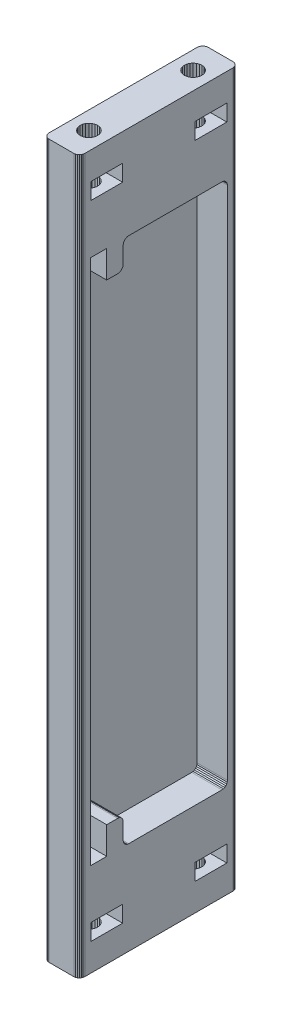
from build123d import *

# Parameters (mm, degrees)
BOSS_EXTRUDE1_DEPTH = 129.999995232
SKETCH2_W           = 5.800001324
SKETCH2_H           = 3.000000492
CUT_EXTRUDE1_DEPTH  = 146.045679533
CUT_EXTRUDE2_REACH  = 146.936
SKETCH4_W           = 5.800001324
SKETCH4_H           = 2.999998629
CUT_EXTRUDE3_DEPTH  = 146.045679533
SKETCH5_W           = 5.800001323
SKETCH5_H           = 2.999998629
CUT_EXTRUDE4_DEPTH  = 146.045679533
CUT_EXTRUDE5_REACH  = 146.936
CUT_EXTRUDE6_REACH  = 146.936
SKETCH8_W           = 5.800001323
SKETCH8_H           = 3.000000492
CUT_EXTRUDE7_DEPTH  = 146.045679533
CUT_EXTRUDE8_REACH  = 146.936
CUT_EXTRUDE9_DEPTH  = 5.49999997
CUT_EXTRUDE10_DEPTH = 6.999999285
CUT_EXTRUDE11_DEPTH = 6.999999285
CUT_EXTRUDE12_DEPTH = 6.999999285
CUT_EXTRUDE13_DEPTH = 6.999999285


with BuildPart() as part:
    # Sketch1 → Boss-Extrude1 (new body)
    with BuildSketch(Plane(origin=(0, 129.999995232, 0), x_dir=(1, 0, 0), z_dir=(0, 1, 0))):
        Polygon((-2.749999985, 35.133976489), (-2.508819103, 35.034071654), (-2.249999903, 35.000000149), (2.249999903, 35.000000149), (2.508819103, 35.034071654), (2.749999985, 35.133976489), (2.957106801, 35.292893648), (3.116025357, 35.500001162), (3.215926001, 35.741180182), (3.250000067, 35.99999845), (3.250000067, 63.000001013), (3.215926001, 63.258819282), (3.116025357, 63.500002027), (2.957106801, 63.707105815), (2.749999985, 63.8660267), (2.508819103, 63.965924084), (2.249999903, 64.00000304), (-2.249999903, 64.00000304), (-2.508819103, 63.965924084), (-2.749999985, 63.8660267), (-2.957106801, 63.707105815), (-3.116025357, 63.500002027), (-3.215926001, 63.258819282), (-3.250000067, 63.000001013), (-3.250000067, 35.99999845), (-3.215926001, 35.741180182), (-3.116025357, 35.500001162), (-2.957106801, 35.292893648), align=None)
    extrude(amount=-BOSS_EXTRUDE1_DEPTH)

    # Sketch2 → Cut-Extrude1 (cut, through all)
    with BuildSketch(Plane(origin=(3.250000067, 0, 0), x_dir=(0, 0, -1), z_dir=(1, 0, 0))):
        with Locations((39.999999106, 6.500000134)):
            Rectangle(SKETCH2_W, SKETCH2_H)
    extrude(amount=-CUT_EXTRUDE1_DEPTH, mode=Mode.SUBTRACT)

    # Sketch3 → Cut-Extrude2 (cut, up to next)
    with BuildSketch(Plane.XZ, mode=Mode.PRIVATE) as cut_extrude2_sk1:
        Polygon((-1.545481267, -40.414113551), (-1.385640586, -40.799997747), (-1.131370896, -41.13136977), (-0.800000038, -41.385639459), (-0.414110487, -41.545484215), (0, -41.600000113), (0.414110487, -41.545484215), (0.800000038, -41.385639459), (1.131370896, -41.13136977), (1.385640586, -40.799997747), (1.545481267, -40.414113551), (1.600000076, -39.999999106), (1.545481267, -39.585888386), (1.385640586, -39.200000465), (1.131370896, -38.868628442), (0.800000038, -38.614362478), (0.414110487, -38.454517722), (0, -38.400001824), (-0.414110487, -38.454517722), (-0.800000038, -38.614362478), (-1.131370896, -38.868628442), (-1.385640586, -39.200000465), (-1.545481267, -39.585888386), (-1.600000076, -39.999999106), align=None)
    cut_extrude2_tool1 = extrude(cut_extrude2_sk1.sketch, amount=-CUT_EXTRUDE2_REACH, mode=Mode.PRIVATE) & part.part
    add(cut_extrude2_tool1.solids().sort_by_distance((0, 0, -40))[0], mode=Mode.SUBTRACT)

    # Sketch4 → Cut-Extrude3 (cut, through all)
    with BuildSketch(Plane(origin=(3.250000067, 0, 0), x_dir=(0, 0, -1), z_dir=(1, 0, 0))):
        with Locations((39.999999106, 123.500000686)):
            Rectangle(SKETCH4_W, SKETCH4_H)
    extrude(amount=-CUT_EXTRUDE3_DEPTH, mode=Mode.SUBTRACT)

    # Sketch5 → Cut-Extrude4 (cut, through all)
    with BuildSketch(Plane(origin=(3.250000067, 0, 0), x_dir=(0, 0, -1), z_dir=(1, 0, 0))):
        with Locations((59.000000357, 123.500000686)):
            Rectangle(SKETCH5_W, SKETCH5_H)
    extrude(amount=-CUT_EXTRUDE4_DEPTH, mode=Mode.SUBTRACT)

    # Sketch6 → Cut-Extrude5 (cut, up to next)
    with BuildSketch(Plane(origin=(0, 129.999995232, 0), x_dir=(-1, 0, 0), z_dir=(0, 1, 0)), mode=Mode.PRIVATE) as cut_extrude5_sk1:
        Polygon((1.545481267, -39.585888386), (1.385640586, -39.200000465), (1.131370896, -38.868628442), (0.800000038, -38.614362478), (0.414110487, -38.454517722), (0, -38.400001824), (-0.414110487, -38.454517722), (-0.800000038, -38.614362478), (-1.131370896, -38.868628442), (-1.385640586, -39.200000465), (-1.545481267, -39.585888386), (-1.600000076, -39.999999106), (-1.545481267, -40.414113551), (-1.385640586, -40.799997747), (-1.131370896, -41.13136977), (-0.800000038, -41.385639459), (-0.414110487, -41.545484215), (0, -41.600000113), (0.414110487, -41.545484215), (0.800000038, -41.385639459), (1.131370896, -41.13136977), (1.385640586, -40.799997747), (1.545481267, -40.414113551), (1.600000076, -39.999999106), align=None)
    cut_extrude5_tool1 = extrude(cut_extrude5_sk1.sketch, amount=-CUT_EXTRUDE5_REACH, mode=Mode.PRIVATE) & part.part
    add(cut_extrude5_tool1.solids().sort_by_distance((0, 129.999995, -40))[0], mode=Mode.SUBTRACT)

    # Sketch7 → Cut-Extrude6 (cut, up to next)
    with BuildSketch(Plane(origin=(0, 129.999995232, 0), x_dir=(-1, 0, 0), z_dir=(0, 1, 0)), mode=Mode.PRIVATE) as cut_extrude6_sk1:
        Polygon((-1.600000076, -59.000000358), (-1.545481267, -59.414111078), (-1.385640586, -59.799998999), (-1.131370896, -60.131371021), (-0.800000038, -60.385640711), (-0.414110487, -60.545481741), (0, -60.59999764), (0.414110487, -60.545481741), (0.800000038, -60.385640711), (1.131370896, -60.131371021), (1.385640586, -59.799998999), (1.545481267, -59.414111078), (1.600000076, -59.000000358), (1.545481267, -58.585889637), (1.385640586, -58.200001717), (1.131370896, -57.868629694), (0.800000038, -57.614360005), (0.414110487, -57.454518974), (0, -57.400003076), (-0.414110487, -57.454518974), (-0.800000038, -57.614360005), (-1.131370896, -57.868629694), (-1.385640586, -58.200001717), (-1.545481267, -58.585889637), align=None)
    cut_extrude6_tool1 = extrude(cut_extrude6_sk1.sketch, amount=-CUT_EXTRUDE6_REACH, mode=Mode.PRIVATE) & part.part
    add(cut_extrude6_tool1.solids().sort_by_distance((0, 129.999995, -59))[0], mode=Mode.SUBTRACT)

    # Sketch8 → Cut-Extrude7 (cut, through all)
    with BuildSketch(Plane(origin=(3.250000067, 0, 0), x_dir=(0, 0, -1), z_dir=(1, 0, 0))):
        with Locations((59.000000357, 6.500000134)):
            Rectangle(SKETCH8_W, SKETCH8_H)
    extrude(amount=-CUT_EXTRUDE7_DEPTH, mode=Mode.SUBTRACT)

    # Sketch9 → Cut-Extrude8 (cut, up to next)
    with BuildSketch(Plane.XZ, mode=Mode.PRIVATE) as cut_extrude8_sk1:
        Polygon((-0.800000038, -57.614360005), (-1.131370896, -57.868629694), (-1.385640586, -58.200001717), (-1.545481267, -58.585889637), (-1.600000076, -59.000000358), (-1.545481267, -59.414111078), (-1.385640586, -59.799998999), (-1.131370896, -60.131371021), (-0.800000038, -60.385640711), (-0.414110487, -60.545481741), (0, -60.59999764), (0.414110487, -60.545481741), (0.800000038, -60.385640711), (1.131370896, -60.131371021), (1.385640586, -59.799998999), (1.545481267, -59.414111078), (1.600000076, -59.000000358), (1.545481267, -58.585889637), (1.385640586, -58.200001717), (1.131370896, -57.868629694), (0.800000038, -57.614360005), (0.414110487, -57.454518974), (0, -57.400003076), (-0.414110487, -57.454518974), align=None)
    cut_extrude8_tool1 = extrude(cut_extrude8_sk1.sketch, amount=-CUT_EXTRUDE8_REACH, mode=Mode.PRIVATE) & part.part
    add(cut_extrude8_tool1.solids().sort_by_distance((0, 0, -59))[0], mode=Mode.SUBTRACT)

    # Sketch10 → Cut-Extrude9 (cut)
    with BuildSketch(Plane(origin=(3.250000067, 0, 0), x_dir=(0, 0, -1), z_dir=(1, 0, 0))):
        Polygon((61.999998987, 17.999999225), (61.999998987, 112.000003457), (61.965927482, 112.258821726), (61.866022646, 112.49999702), (61.707109213, 112.707108259), (61.500001699, 112.866029143), (61.258818954, 112.965926528), (61.000000685, 112.999998033), (43.999999762, 112.999998033), (43.741181493, 112.965926528), (43.499998748, 112.866029143), (43.292891234, 112.707108259), (43.133977801, 112.49999702), (43.034072965, 112.258821726), (43.00000146, 112.000003457), (43.00000146, 108.999997377), (42.96592623, 108.741179109), (42.86602512, 108.499996364), (42.707107961, 108.292892575), (42.500000447, 108.133971691), (42.258821428, 108.034074306), (41.999999434, 108.000002801), (39.999999106, 108.000002801), (39.999999106, 112.999998033), (37.000000477, 112.999998033), (37.000000477, 17.000000924), (39.999999106, 17.000000924), (39.999999106, 21.999999881), (41.999999434, 21.999999881), (42.258821428, 21.96592465), (42.500000447, 21.866025403), (42.707107961, 21.707108244), (42.86602512, 21.50000073), (42.96592623, 21.258819848), (43.00000146, 20.999999717), (43.00000146, 17.999999225), (43.034072965, 17.741180956), (43.133977801, 17.500000075), (43.292891234, 17.29289256), (43.499998748, 17.133973539), (43.741181493, 17.034074292), (43.999999762, 17.000000924), (61.000000685, 17.000000924), (61.258818954, 17.034074292), (61.500001699, 17.133973539), (61.707109213, 17.29289256), (61.866022646, 17.500000075), (61.965927482, 17.741180956), align=None)
    extrude(amount=-CUT_EXTRUDE9_DEPTH, mode=Mode.SUBTRACT)

    # Sketch11 → Cut-Extrude10 (cut)
    with BuildSketch(Plane(origin=(0, 122.000001371, 0), x_dir=(-1, 0, 0), z_dir=(0, 1, 0))):
        Polygon((1.545481267, -40.414113551), (1.600000076, -39.999999106), (1.545481267, -39.585888386), (1.385640586, -39.200000465), (1.131370896, -38.868628442), (0.800000038, -38.614362478), (0.414110487, -38.454517722), (0, -38.400001824), (-0.414110487, -38.454517722), (-0.800000038, -38.614362478), (-1.131370896, -38.868628442), (-1.385640586, -39.200000465), (-1.545481267, -39.585888386), (-1.600000076, -39.999999106), (-1.545481267, -40.414113551), (-1.385640586, -40.799997747), (-1.131370896, -41.13136977), (-0.800000038, -41.385639459), (-0.414110487, -41.545484215), (0, -41.600000113), (0.414110487, -41.545484215), (0.800000038, -41.385639459), (1.131370896, -41.13136977), (1.385640586, -40.799997747), align=None)
    extrude(amount=-CUT_EXTRUDE10_DEPTH, mode=Mode.SUBTRACT)

    # Sketch12 → Cut-Extrude11 (cut)
    with BuildSketch(Plane(origin=(0, 122.000001371, 0), x_dir=(-1, 0, 0), z_dir=(0, 1, 0))):
        Polygon((1.545481267, -59.414111078), (1.600000076, -59.000000358), (1.545481267, -58.585889637), (1.385640586, -58.200001717), (1.131370896, -57.868629694), (0.800000038, -57.614360005), (0.414110487, -57.454518974), (0, -57.400003076), (-0.414110487, -57.454518974), (-0.800000038, -57.614360005), (-1.131370896, -57.868629694), (-1.385640586, -58.200001717), (-1.545481267, -58.585889637), (-1.600000076, -59.000000358), (-1.545481267, -59.414111078), (-1.385640586, -59.799998999), (-1.131370896, -60.131371021), (-0.800000038, -60.385640711), (-0.414110487, -60.545481741), (0, -60.59999764), (0.414110487, -60.545481741), (0.800000038, -60.385640711), (1.131370896, -60.131371021), (1.385640586, -59.799998999), align=None)
    extrude(amount=-CUT_EXTRUDE11_DEPTH, mode=Mode.SUBTRACT)

    # Sketch13 → Cut-Extrude12 (cut)
    with BuildSketch(Plane.XZ.offset(-8.00000038)):
        Polygon((-0.414110487, -41.545484215), (0, -41.600000113), (0.414110487, -41.545484215), (0.800000038, -41.385639459), (1.131370896, -41.13136977), (1.385640586, -40.799997747), (1.545481267, -40.414113551), (1.600000076, -39.999999106), (1.545481267, -39.585888386), (1.385640586, -39.200000465), (1.131370896, -38.868628442), (0.800000038, -38.614362478), (0.414110487, -38.454517722), (0, -38.400001824), (-0.414110487, -38.454517722), (-0.800000038, -38.614362478), (-1.131370896, -38.868628442), (-1.385640586, -39.200000465), (-1.545481267, -39.585888386), (-1.600000076, -39.999999106), (-1.545481267, -40.414113551), (-1.385640586, -40.799997747), (-1.131370896, -41.13136977), (-0.800000038, -41.385639459), align=None)
    extrude(amount=-CUT_EXTRUDE12_DEPTH, mode=Mode.SUBTRACT)

    # Sketch14 → Cut-Extrude13 (cut)
    with BuildSketch(Plane.XZ.offset(-8.00000038)):
        Polygon((-0.414110487, -60.545481741), (0, -60.59999764), (0.414110487, -60.545481741), (0.800000038, -60.385640711), (1.131370896, -60.131371021), (1.385640586, -59.799998999), (1.545481267, -59.414111078), (1.600000076, -59.000000358), (1.545481267, -58.585889637), (1.385640586, -58.200001717), (1.131370896, -57.868629694), (0.800000038, -57.614360005), (0.414110487, -57.454518974), (0, -57.400003076), (-0.414110487, -57.454518974), (-0.800000038, -57.614360005), (-1.131370896, -57.868629694), (-1.385640586, -58.200001717), (-1.545481267, -58.585889637), (-1.600000076, -59.000000358), (-1.545481267, -59.414111078), (-1.385640586, -59.799998999), (-1.131370896, -60.131371021), (-0.800000038, -60.385640711), align=None)
    extrude(amount=-CUT_EXTRUDE13_DEPTH, mode=Mode.SUBTRACT)


solid = part.part
